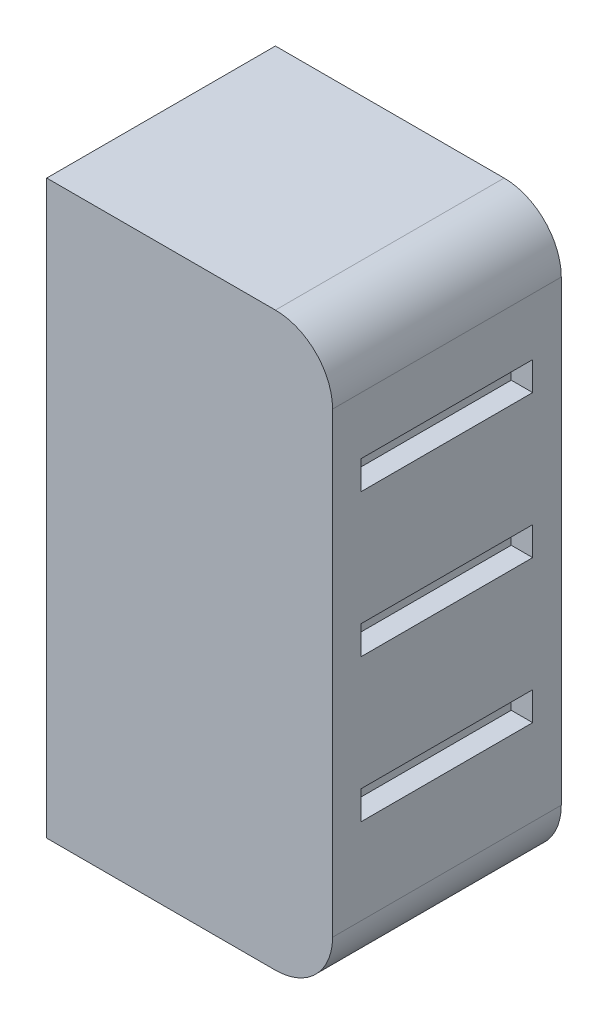
from build123d import *

# Parameters (mm, degrees)
SKETCH1_W           = 10
SKETCH1_H           = 20
BOSS_EXTRUDE1_DEPTH = 8
FILLET3_R           = 2
SKETCH2_W           = 6
SKETCH2_H           = 1
CUT_EXTRUDE1_DEPTH  = 0.75
LPATTERN1_COUNT     = 3
LPATTERN1_PITCH     = 5


with BuildPart() as part:
    # Sketch1 → Boss-Extrude1 (new body)
    with BuildSketch(Plane.XY):
        Rectangle(SKETCH1_W, SKETCH1_H)
    extrude(amount=BOSS_EXTRUDE1_DEPTH)

    # Fillet3
    fillet3_edges = [part.edges().sort_by_distance(p)[0] for p in [
        (5, 10, 4),
        (5, -10, 4),
    ]]
    fillet(fillet3_edges, radius=FILLET3_R)

    # Sketch2 → Cut-Extrude1 (cut)
    with BuildSketch(Plane(origin=(5, 0, 0), x_dir=(0, 0, -1), z_dir=(1, 0, 0))):
        with Locations((-4, -4.5)):
            Rectangle(SKETCH2_W, SKETCH2_H)
    cut_extrude1 = extrude(amount=-CUT_EXTRUDE1_DEPTH, mode=Mode.SUBTRACT)

    # LPattern1: Cut-Extrude1 ×3
    with Locations(*[(0, i * LPATTERN1_PITCH, 0) for i in range(1, LPATTERN1_COUNT)]):
        add(cut_extrude1, mode=Mode.SUBTRACT)


solid = part.part
